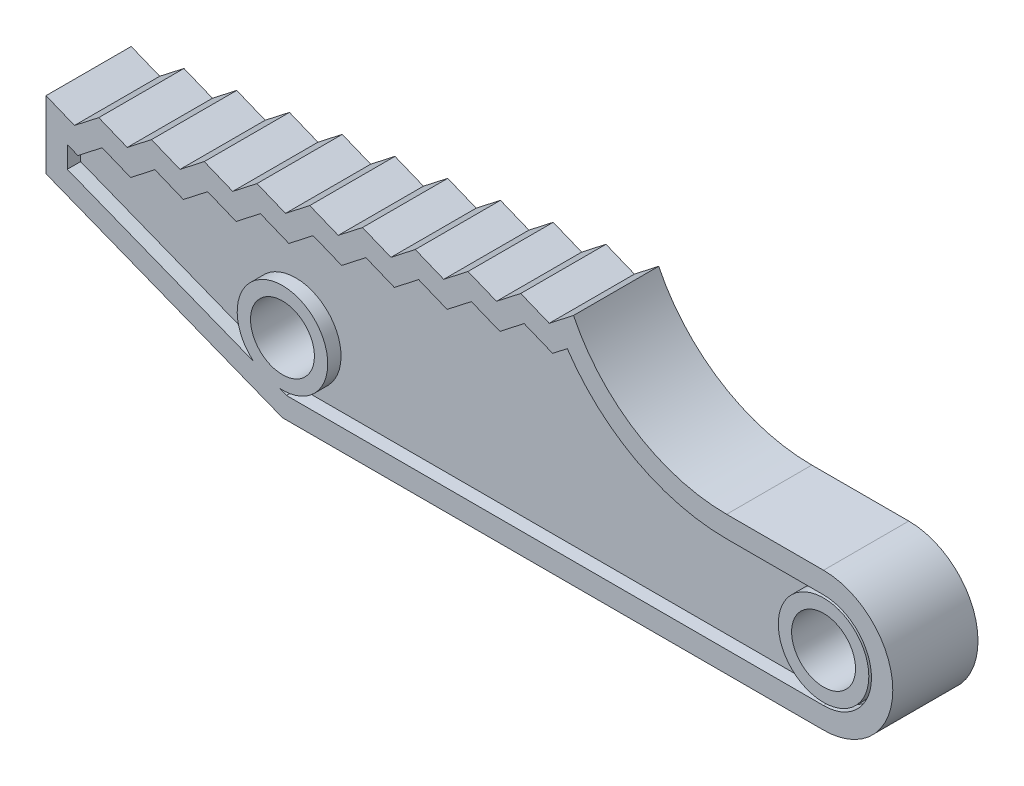
from build123d import *

# Parameters (mm, degrees)
SKETCH1_R           = 3
BOSS_EXTRUDE1_DEPTH = 4
CUT_EXTRUDE3_DEPTH  = 82.313525364
CUT_EXTRUDE2_DEPTH  = 1.25
SKETCH6_R           = 4.25
SKETCH6_R_2         = 3
BOSS_EXTRUDE2_DEPTH = 1.25
SKETCH7_R           = 4.25
CUT_EXTRUDE4_DEPTH  = 1.2


with BuildPart() as part:
    # Sketch1 → Boss-Extrude1 (new, symmetric)
    with BuildSketch(Plane.XY):
        with BuildLine():
            Line((0, -6.35), (0, 0))
            Line((0, 0), (49.523071285, 6.889514534))
            ThreePointArc((49.523071285, 6.889514534), (55.424924624, 0.340905899), (63.899469217, -2.087723723))
            Line((63.899469217, -2.087723723), (73, -2.087723723))
            ThreePointArc((73, -2.087723723), (79.5, -8.587723723), (73, -15.087723723))
            Line((73, -15.087723723), (22.2, -15.087723723))
            Line((22.2, -15.087723723), (0, -6.35))
        make_face()
        with Locations((73, -8.587723723)):
            Circle(SKETCH1_R, mode=Mode.SUBTRACT)
        with Locations((22.2, -8.587723723)):
            Circle(SKETCH1_R, mode=Mode.SUBTRACT)
    extrude(amount=BOSS_EXTRUDE1_DEPTH, both=True)

    # Sketch5 → Cut-Extrude3 (cut, through all)
    with BuildSketch(Plane.XY.offset(4)):
        Polygon((4.952307128, 0.688951453), (0, 0), (2.675036718, -1.0851322), align=None)
        Polygon((49.523071285, 6.889514534), (44.570764156, 6.200563081), (47.245800874, 5.115430881), align=None)
        Polygon((44.570764156, 6.200563081), (39.618457028, 5.511611627), (42.293493746, 4.426479427), align=None)
        Polygon((39.618457028, 5.511611627), (34.666149899, 4.822660174), (37.341186617, 3.737527974), align=None)
        Polygon((34.666149899, 4.822660174), (29.713842771, 4.133708721), (32.388879489, 3.04857652), align=None)
        Polygon((29.713842771, 4.133708721), (24.761535642, 3.444757267), (27.43657236, 2.359625067), align=None)
        Polygon((24.761535642, 3.444757267), (19.809228514, 2.755805814), (22.484265232, 1.670673614), align=None)
        Polygon((19.809228514, 2.755805814), (14.856921385, 2.06685436), (17.531958103, 0.98172216), align=None)
        Polygon((14.856921385, 2.06685436), (9.904614257, 1.377902907), (12.579650975, 0.292770707), align=None)
        Polygon((9.904614257, 1.377902907), (4.952307128, 0.688951453), (7.627343846, -0.396180747), align=None)
    extrude(amount=-CUT_EXTRUDE3_DEPTH, mode=Mode.SUBTRACT)

    # Sketch4 → Cut-Extrude2 (cut)
    with BuildSketch(Plane.XY.offset(4)):
        with BuildLine():
            Line((22.579425451, -13.087723723), (73, -13.087723723))
            ThreePointArc((73, -13.087723723), (77.5, -8.587723723), (73, -4.087723723))
            Line((73, -4.087723723), (63.899469217, -4.087723723))
            ThreePointArc((63.899469217, -4.087723723), (55.420413641, -1.965557849), (48.940687218, 3.900541107))
            Line((48.940687218, 3.900541107), (47.56401392, 2.828058198))
            Line((47.56401392, 2.828058198), (44.888977202, 3.913190398))
            Line((44.888977202, 3.913190398), (42.611706791, 2.139106744))
            Line((42.611706791, 2.139106744), (39.936670074, 3.224238944))
            Line((39.936670074, 3.224238944), (37.659399663, 1.450155291))
            Line((37.659399663, 1.450155291), (34.984362945, 2.535287491))
            Line((34.984362945, 2.535287491), (32.707092534, 0.761203837))
            Line((32.707092534, 0.761203837), (30.032055817, 1.846336038))
            Line((30.032055817, 1.846336038), (27.754785406, 0.072252384))
            Line((27.754785406, 0.072252384), (25.079748688, 1.157384584))
            Line((25.079748688, 1.157384584), (22.802478277, -0.616699069))
            Line((22.802478277, -0.616699069), (20.12744156, 0.468433131))
            Line((20.12744156, 0.468433131), (17.850171149, -1.305650523))
            Line((17.850171149, -1.305650523), (15.175134431, -0.220518323))
            Line((15.175134431, -0.220518323), (12.89786402, -1.994601976))
            Line((12.89786402, -1.994601976), (10.222827303, -0.909469776))
            Line((10.222827303, -0.909469776), (7.945556892, -2.68355343))
            Line((7.945556892, -2.68355343), (5.270520174, -1.59842123))
            Line((5.270520174, -1.59842123), (2.993249763, -3.372504883))
            Line((2.993249763, -3.372504883), (2, -2.969591796))
            Line((2, -2.969591796), (2, -4.987843814))
            Line((2, -4.987843814), (22.579425451, -13.087723723))
        make_face()
    extrude(amount=-CUT_EXTRUDE2_DEPTH, mode=Mode.SUBTRACT)

    # Sketch6 → Boss-Extrude2 (add)
    # profile 1 of 2: a face of its own
    with BuildSketch(Plane.XY.offset(2.75)):
        with Locations((22.2, -8.587723723)):
            Circle(SKETCH6_R)
        with Locations((22.2, -8.587723723)):
            Circle(SKETCH6_R_2, mode=Mode.SUBTRACT)
    # profile 2 of 2: a face of its own
    with BuildSketch(Plane.XY.offset(2.75)):
        with Locations((73, -8.587723723)):
            Circle(SKETCH6_R)
        with Locations((73, -8.587723723)):
            Circle(SKETCH6_R_2, mode=Mode.SUBTRACT)
    extrude(amount=BOSS_EXTRUDE2_DEPTH)

    # Sketch7 → Cut-Extrude4 (cut)
    with BuildSketch(Plane(origin=(0, 0, -4), x_dir=(-1, 0, 0), z_dir=(0, 0, -1))):
        with BuildLine():
            Line((-20.12744156, 0.468433131), (-22.802478277, -0.616699069))
            Line((-22.802478277, -0.616699069), (-25.079748688, 1.157384584))
            Line((-25.079748688, 1.157384584), (-27.754785406, 0.072252384))
            Line((-27.754785406, 0.072252384), (-30.032055817, 1.846336038))
            Line((-30.032055817, 1.846336038), (-32.707092534, 0.761203837))
            Line((-32.707092534, 0.761203837), (-34.984362945, 2.535287491))
            Line((-34.984362945, 2.535287491), (-37.659399663, 1.450155291))
            Line((-37.659399663, 1.450155291), (-39.936670074, 3.224238944))
            Line((-39.936670074, 3.224238944), (-42.611706791, 2.139106744))
            Line((-42.611706791, 2.139106744), (-44.888977202, 3.913190398))
            Line((-44.888977202, 3.913190398), (-47.56401392, 2.828058198))
            Line((-47.56401392, 2.828058198), (-48.940687218, 3.900541107))
            ThreePointArc((-48.940687218, 3.900541107), (-55.420413641, -1.965557849), (-63.899469217, -4.087723723))
            Line((-63.899469217, -4.087723723), (-73, -4.087723723))
            ThreePointArc((-73, -4.087723723), (-77.5, -8.587723723), (-73, -13.087723723))
            Line((-73, -13.087723723), (-22.579425451, -13.087723723))
            Line((-22.579425451, -13.087723723), (-21.920947479, -12.828552615))
            ThreePointArc((-21.920947479, -12.828552615), (-23.756536974, -4.633018595), (-19.513668259, -11.881068798))
            Line((-19.513668259, -11.881068798), (-2, -4.987843814))
            Line((-2, -4.987843814), (-2, -2.969591796))
            Line((-2, -2.969591796), (-2.993249763, -3.372504883))
            Line((-2.993249763, -3.372504883), (-5.270520174, -1.59842123))
            Line((-5.270520174, -1.59842123), (-7.945556892, -2.68355343))
            Line((-7.945556892, -2.68355343), (-10.222827303, -0.909469776))
            Line((-10.222827303, -0.909469776), (-12.89786402, -1.994601976))
            Line((-12.89786402, -1.994601976), (-15.175134431, -0.220518323))
            Line((-15.175134431, -0.220518323), (-17.850171149, -1.305650523))
            Line((-17.850171149, -1.305650523), (-20.12744156, 0.468433131))
        make_face()
        with Locations(Location((-73, -8.587723723, 0), (0, 0, 180))):
            Circle(SKETCH7_R, mode=Mode.SUBTRACT)
    extrude(amount=-CUT_EXTRUDE4_DEPTH, mode=Mode.SUBTRACT)


solid = part.part
